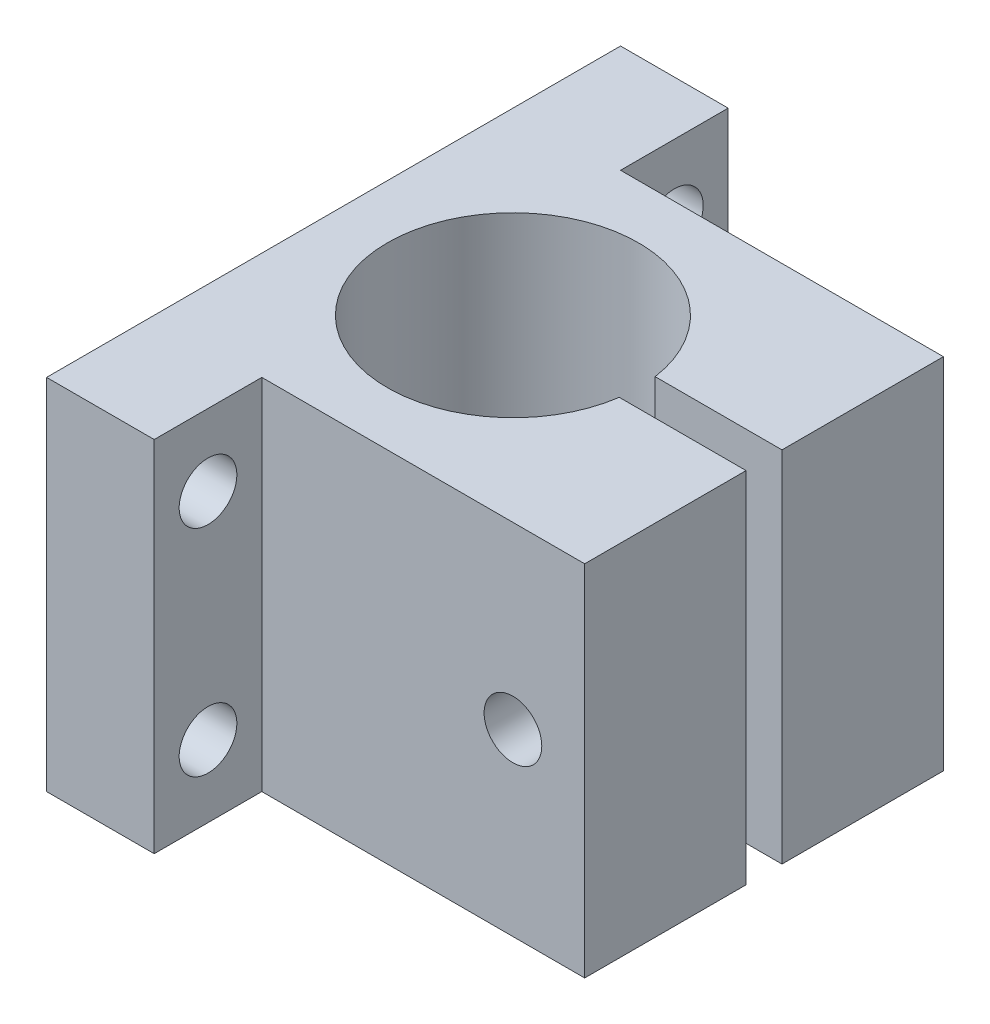
from build123d import *

# Parameters (mm, degrees)
SKETCH1_W                  = 38.1
SKETCH1_H                  = 50.8
BOSS_EXTRUDE1_DEPTH        = 31.75
SKETCH2_R                  = 11.1125
CUT_EXTRUDE1_DEPTH         = 45.901280605
SKETCH3_W                  = 28.575
SKETCH3_H                  = 9.525
CUT_EXTRUDE2_DEPTH         = 45.901280605
F_10_CLEARANCE_HOLE1_D     = 5.1054
F_10_CLEARANCE_HOLE1_DEPTH = 9.652
F_10_CLEARANCE_HOLE1_TIP   = 1.533816902
SKETCH6_W                  = 3.175
SKETCH6_H                  = 31.75
CUT_EXTRUDE3_DEPTH         = 24.13
F_10_CLEARANCE_HOLE2_D     = 5.1054


with BuildPart() as part:
    # Sketch1 → Boss-Extrude1 (new body)
    with BuildSketch(Plane(origin=(0, 0, 0), x_dir=(1, 0, 0), z_dir=(0, 1, 0))):
        Rectangle(SKETCH1_W, SKETCH1_H)
    extrude(amount=BOSS_EXTRUDE1_DEPTH)

    # Sketch2 → Cut-Extrude1 (cut, through all)
    with BuildSketch(Plane(origin=(0, 31.75, 0), x_dir=(1, 0, 0), z_dir=(0, 1, 0))):
        with Locations(Location((-3.175, 0, 0), (0, 0, 270))):
            Circle(SKETCH2_R)
    extrude(amount=-CUT_EXTRUDE1_DEPTH, mode=Mode.SUBTRACT)

    # Sketch3 → Cut-Extrude2 (cut, through all)
    with BuildSketch(Plane(origin=(0, 31.75, 0), x_dir=(1, 0, 0), z_dir=(0, 1, 0))):
        with Locations((4.7625, 20.6375)):
            Rectangle(SKETCH3_W, SKETCH3_H)
        with Locations((4.7625, -20.6375)):
            Rectangle(SKETCH3_W, SKETCH3_H)
    extrude(amount=-CUT_EXTRUDE2_DEPTH, mode=Mode.SUBTRACT)

    # #10 Clearance Hole1
    with Locations(Plane(origin=(-9.525, 0, 0), x_dir=(0, 0, -1), z_dir=(1, 0, 0))):
        with Locations((-20.6375, 25.4), (20.6375, 6.35), (-20.6375, 6.35), (20.6375, 25.4)):
            Hole(F_10_CLEARANCE_HOLE1_D / 2, depth=F_10_CLEARANCE_HOLE1_DEPTH)
            with Locations((0, 0, -(F_10_CLEARANCE_HOLE1_DEPTH + F_10_CLEARANCE_HOLE1_TIP / 2))):  # 118° drill point
                Cone(0, F_10_CLEARANCE_HOLE1_D / 2, F_10_CLEARANCE_HOLE1_TIP, mode=Mode.SUBTRACT)

    # Sketch6 → Cut-Extrude3 (cut)
    with BuildSketch(Plane(origin=(19.05, 0, 0), x_dir=(0, 0, -1), z_dir=(1, 0, 0))):
        with Locations((0, 15.875)):
            Rectangle(SKETCH6_W, SKETCH6_H)
    extrude(amount=-CUT_EXTRUDE3_DEPTH, mode=Mode.SUBTRACT)

    # #10 Clearance Hole2 (through all)
    with Locations(Plane.XY.offset(15.875)):
        with Locations((12.7, 15.875)):
            Hole(F_10_CLEARANCE_HOLE2_D / 2)


solid = part.part
